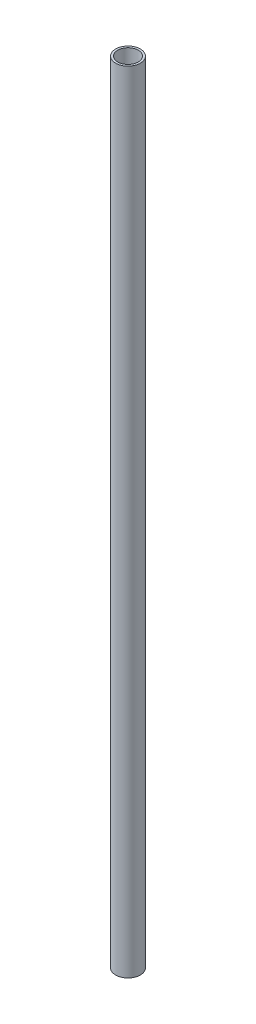
from build123d import *

# Parameters (mm, degrees)
SKETCH1_R           = 6.35
SKETCH1_R_2         = 5.2832
BOSS_EXTRUDE1_DEPTH = 406.4


with BuildPart() as part:
    # Sketch1 → Boss-Extrude1 (new body)
    with BuildSketch(Plane(origin=(0, 0, 0), x_dir=(1, 0, 0), z_dir=(0, 1, 0))):
        with Locations(Location((0, 0, 0), (0, 0, 270))):
            Circle(SKETCH1_R)
        with Locations(Location((0, 0, 0), (0, 0, 270))):
            Circle(SKETCH1_R_2, mode=Mode.SUBTRACT)
    extrude(amount=BOSS_EXTRUDE1_DEPTH)


solid = part.part
